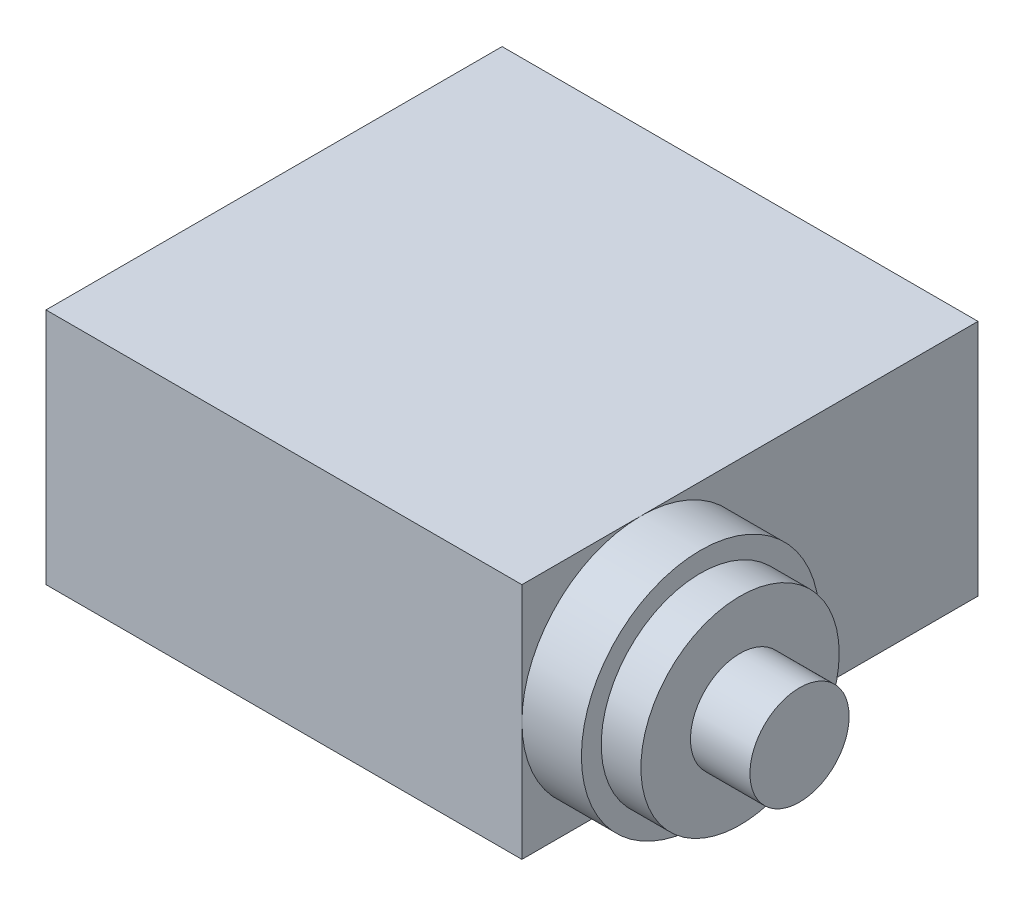
from build123d import *

# Parameters (mm, degrees)
SCHIZZO1_W                   = 24
SCHIZZO1_H                   = 23
CORPOCENTRALE_DEPTH          = 12
SCHIZZO2_R                   = 6
ESTRUSIONE_ESTRUSIONE2_DEPTH = 3
SCHIZZO3_R                   = 5
ESTRUSIONE_ESTRUSIONE3_DEPTH = 2
SCHIZZO4_R                   = 2.5
ESTRUSIONE_ESTRUSIONE4_DEPTH = 3


with BuildPart() as part:
    # Schizzo1 → CorpoCentrale (new body)
    with BuildSketch(Plane(origin=(0, 0, 0), x_dir=(1, 0, 0), z_dir=(0, 1, 0))):
        Rectangle(SCHIZZO1_W, SCHIZZO1_H)
    extrude(amount=CORPOCENTRALE_DEPTH)

    # Schizzo2 → Estrusione-Estrusione2 (add)
    with BuildSketch(Plane(origin=(12, 0, 0), x_dir=(0, 0, -1), z_dir=(1, 0, 0))):
        with Locations(Location((-5.5, 6, 0), (0, 0, 180))):
            Circle(SCHIZZO2_R)
    extrude(amount=ESTRUSIONE_ESTRUSIONE2_DEPTH)

    # Schizzo3 → Estrusione-Estrusione3 (add)
    with BuildSketch(Plane(origin=(15, 0, 0), x_dir=(0, 0, -1), z_dir=(1, 0, 0))):
        with Locations((-5.5, 6)):
            Circle(SCHIZZO3_R)
    extrude(amount=ESTRUSIONE_ESTRUSIONE3_DEPTH)

    # Schizzo4 → Estrusione-Estrusione4 (add)
    with BuildSketch(Plane(origin=(17, 0, 0), x_dir=(0, 0, -1), z_dir=(1, 0, 0))):
        with Locations((-5.5, 6)):
            Circle(SCHIZZO4_R)
    extrude(amount=ESTRUSIONE_ESTRUSIONE4_DEPTH)


solid = part.part
